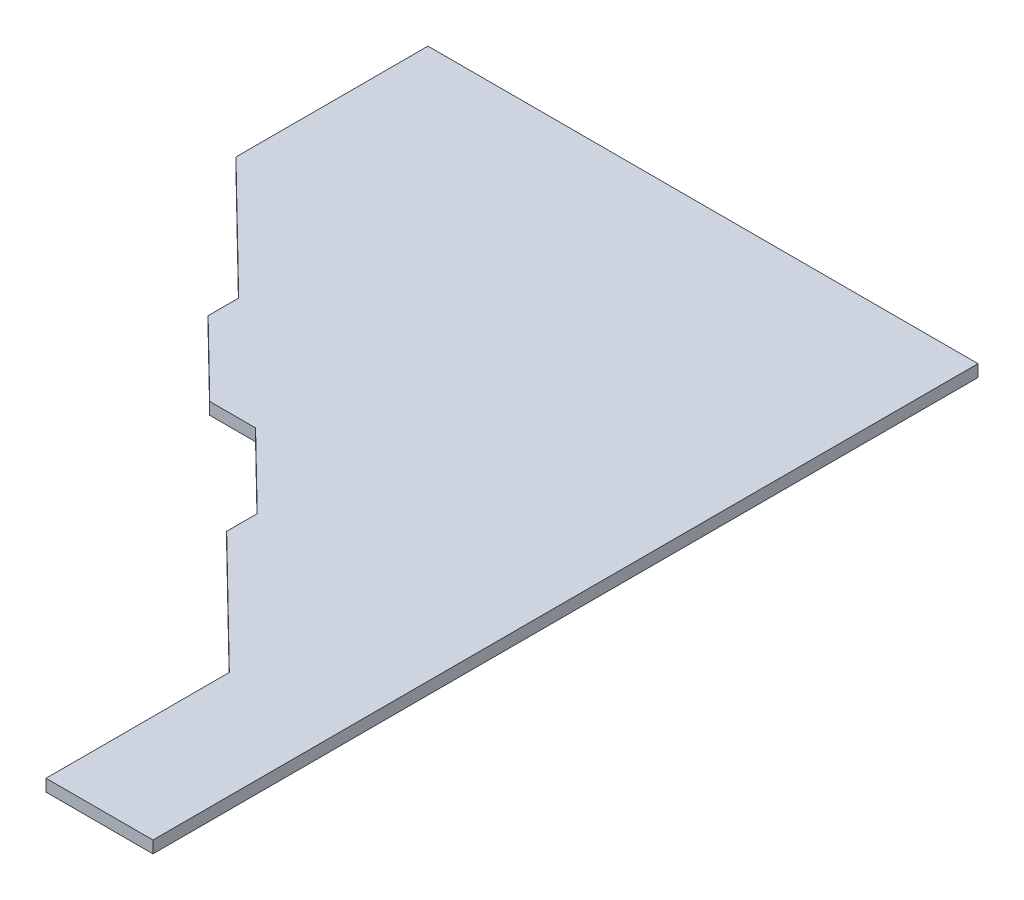
from build123d import *

# Parameters (mm, degrees)
BOSS_EXTRUDE1_DEPTH = 1


with BuildPart() as part:
    # Sketch1 → Boss-Extrude1 (new body)
    with BuildSketch(Plane(origin=(0, 0, 0), x_dir=(1, 0, 0), z_dir=(0, 1, 0))):
        Polygon((0, 0), (0, 68.58), (-45.72, 68.58), (-45.72, 52.62), (-35.448926703, 42.572887114), (-35.448926703, 40.032887114), (-29.21, 33.93), (-25.4, 33.93), (-19.161073297, 27.827112886), (-19.161073297, 25.287112886), (-8.89, 15.24), (-8.89, 0), align=None)
    extrude(amount=BOSS_EXTRUDE1_DEPTH)


solid = part.part
